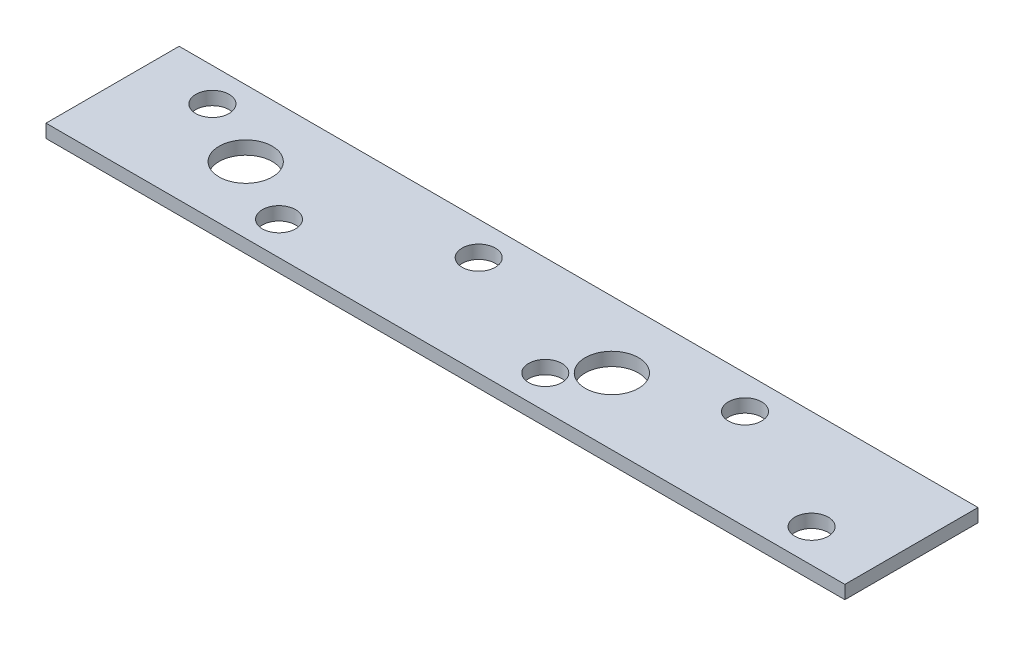
from build123d import *

# Parameters (mm, degrees)
SKETCH_2_W      = 120
SKETCH_2_H      = 20
SKETCH_2_R      = 2.5
SKETCH_2_R_2    = 4
EXTRUDE_1_DEPTH = 2


with BuildPart() as part:
    # Эскиз2 → Бобышка-Вытянуть1 (new body)
    with BuildSketch(Plane(origin=(0, 0, 0), x_dir=(1, 0, 0), z_dir=(0, 1, 0))):
        Rectangle(SKETCH_2_W, SKETCH_2_H)
        with Locations(Location((-50, 5, 0), (0, 0, 270))):
            Circle(SKETCH_2_R, mode=Mode.SUBTRACT)
        with Locations(Location((-10, 5, 0), (0, 0, 270))):
            Circle(SKETCH_2_R, mode=Mode.SUBTRACT)
        with Locations(Location((30, 5, 0), (0, 0, 270))):
            Circle(SKETCH_2_R, mode=Mode.SUBTRACT)
        with Locations(Location((-30, -5, 0), (0, 0, 270))):
            Circle(SKETCH_2_R, mode=Mode.SUBTRACT)
        with Locations(Location((10, -5, 0), (0, 0, 270))):
            Circle(SKETCH_2_R, mode=Mode.SUBTRACT)
        with Locations(Location((50, -5, 0), (0, 0, 270))):
            Circle(SKETCH_2_R, mode=Mode.SUBTRACT)
        with Locations(Location((-40, 0, 0), (0, 0, 270))):
            Circle(SKETCH_2_R_2, mode=Mode.SUBTRACT)
        with Locations(Location((15, 0, 0), (0, 0, 270))):
            Circle(SKETCH_2_R_2, mode=Mode.SUBTRACT)
    extrude(amount=EXTRUDE_1_DEPTH)


solid = part.part
